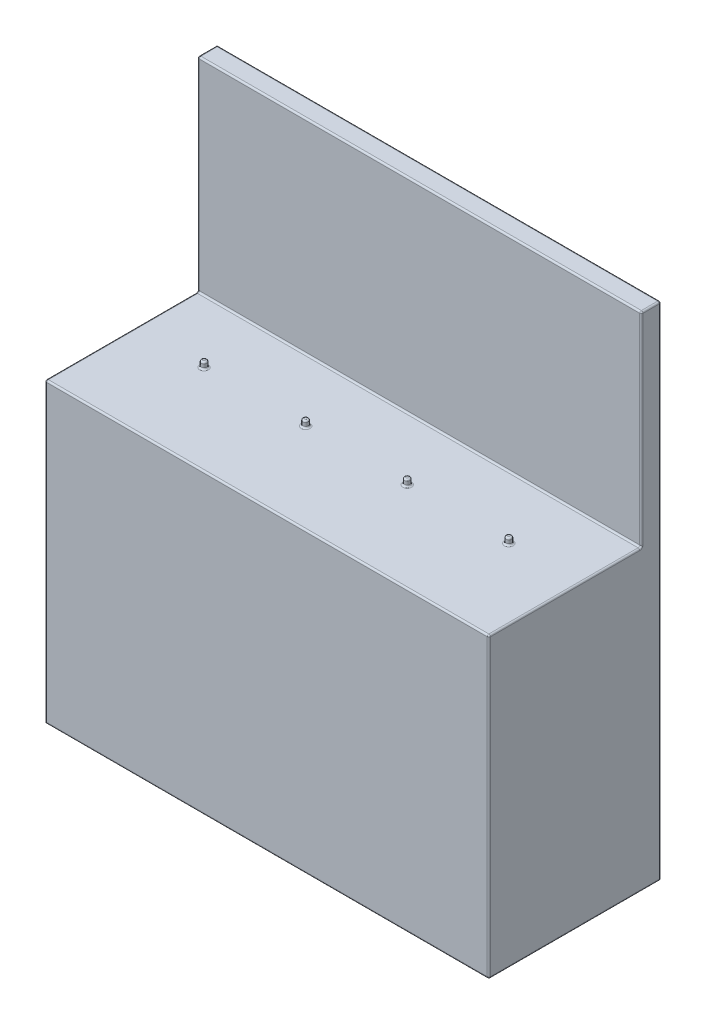
from build123d import *

# Parameters (mm, degrees)
SKETCH2_W           = 1354
SKETCH2_H           = 525
BOSS_EXTRUDE1_DEPTH = 908
SKETCH3_W           = 1354
SKETCH3_H           = 59.6
BOSS_EXTRUDE2_DEPTH = 622
SKETCH4_R           = 8.5
BOSS_EXTRUDE3_DEPTH = 20
FILLET2_R           = 5


with BuildPart() as part:
    # Sketch2 → Boss-Extrude1 (new body)
    with BuildSketch(Plane(origin=(0, 0, 0), x_dir=(1, 0, 0), z_dir=(0, 1, 0))):
        with Locations((677, 262.5)):
            Rectangle(SKETCH2_W, SKETCH2_H)
    extrude(amount=BOSS_EXTRUDE1_DEPTH)

    # Sketch3 → Boss-Extrude2 (add)
    with BuildSketch(Plane(origin=(0, 908, 0), x_dir=(1, 0, 0), z_dir=(0, 1, 0))):
        with Locations((677, 495.2)):
            Rectangle(SKETCH3_W, SKETCH3_H)
    extrude(amount=BOSS_EXTRUDE2_DEPTH)

    # Sketch4 → Boss-Extrude3 (add)
    with BuildSketch(Plane(origin=(0, 908, 0), x_dir=(1, 0, 0), z_dir=(0, 1, 0))):
        with Locations(Location((210, 275, 0), (0, 0, 90))):
            Circle(SKETCH4_R)
        with Locations(Location((520, 275, 0), (0, 0, 90))):
            Circle(SKETCH4_R)
        with Locations(Location((830, 275, 0), (0, 0, 90))):
            Circle(SKETCH4_R)
        with Locations(Location((1140, 275, 0), (0, 0, 90))):
            Circle(SKETCH4_R)
    extrude(amount=BOSS_EXTRUDE3_DEPTH)

    # Fillet2
    fillet2_edges = [part.edges().sort_by_distance(p)[0] for p in [
        (1354, 908, -232.7),
        (0, 908, -232.7),
        (677, 908, -465.4),
        (0, 1219, -465.4),
        (1354, 1219, -465.4),
        (0, 1530, -495.2),
        (677, 1530, -465.4),
        (1354, 1530, -495.2),
        (677, 1530, -525),
        (210, 908, -266.5),
        (210, 928, -266.5),
        (520, 908, -266.5),
        (520, 928, -266.5),
        (830, 908, -266.5),
        (830, 928, -266.5),
        (1140, 908, -266.5),
        (1140, 928, -266.5),
        (1354, 0, -262.5),
        (677, 0, 0),
        (677, 908, 0),
        (1354, 765, -525),
        (1354, 454, 0),
        (0, 454, 0),
    ]]
    fillet(fillet2_edges, radius=FILLET2_R)


solid = part.part
